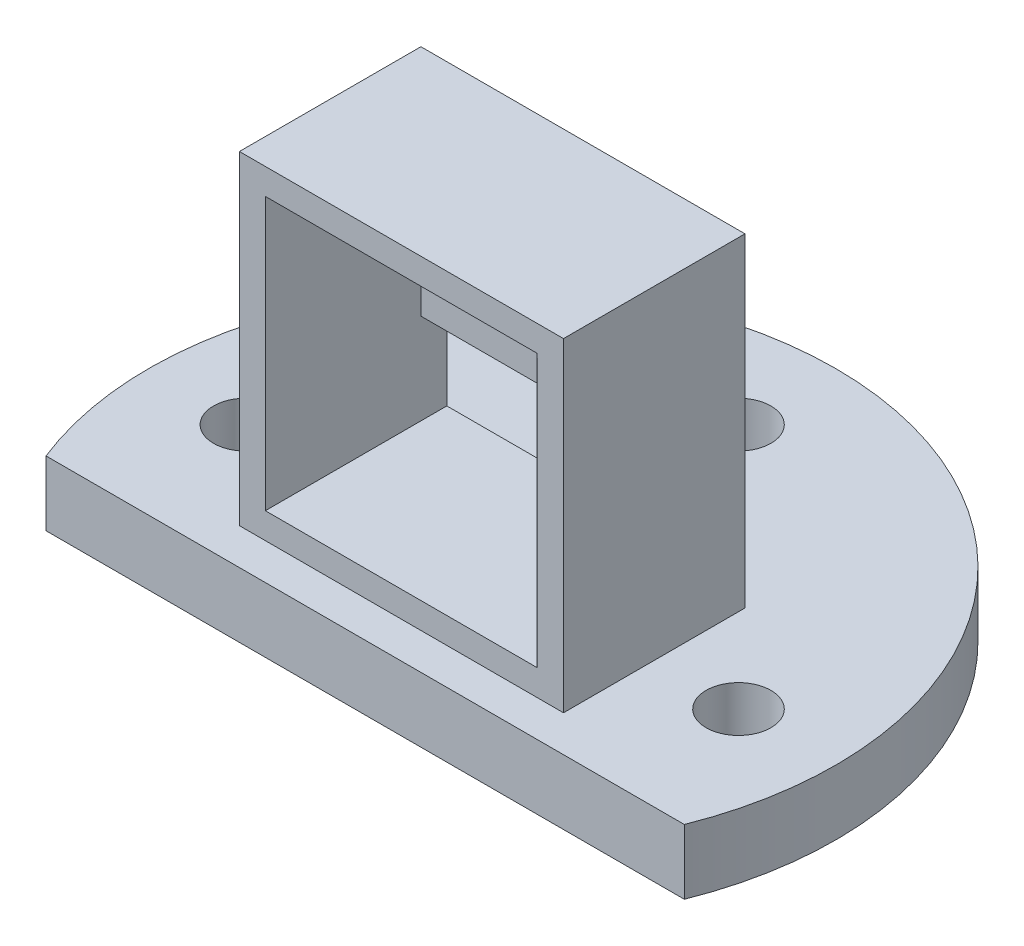
from build123d import *

# Parameters (mm, degrees)
SKETCH1_R           = 5
BOSS_EXTRUDE4_DEPTH = 10
SKETCH5_W           = 50
SKETCH5_H           = 28
BOSS_EXTRUDE5_DEPTH = 50
SKETCH6_W           = 42
SKETCH6_H           = 42
BOSS_EXTRUDE7_DEPTH = 24
SKETCH9_W           = 41.892865088
SKETCH9_H           = 42
CUT_EXTRUDE1_DEPTH  = 24
SKETCH10_W          = 41.892865088
SKETCH10_H          = 12
CUT_EXTRUDE6_DEPTH  = 4
SKETCH11_W          = 41.892865088
SKETCH11_H          = 14
CUT_EXTRUDE7_DEPTH  = 4


with BuildPart() as part:
    # Sketch1 → Boss-Extrude4 (new body)
    with BuildSketch(Plane(origin=(0, 0, 0), x_dir=(1, 0, 0), z_dir=(0, 1, 0))):
        with BuildLine():
            Line((-49.242854308, -19.599522943), (49.242854308, -19.599522943))
            ThreePointArc((49.242854308, -19.599522943), (0, 53), (-49.242854308, -19.599522943))
        make_face()
        with Locations(Location((-38, 0, 0), (0, 0, 270))):
            Circle(SKETCH1_R, mode=Mode.SUBTRACT)
        with Locations(Location((38, 0, 0), (0, 0, 270))):
            Circle(SKETCH1_R, mode=Mode.SUBTRACT)
        with Locations(Location((0, 38, 0), (0, 0, 270))):
            Circle(SKETCH1_R, mode=Mode.SUBTRACT)
    extrude(amount=BOSS_EXTRUDE4_DEPTH)

    # Sketch5 → Boss-Extrude5 (add)
    with BuildSketch(Plane(origin=(0, 10, 0), x_dir=(1, 0, 0), z_dir=(0, 1, 0))):
        Rectangle(SKETCH5_W, SKETCH5_H)
    extrude(amount=BOSS_EXTRUDE5_DEPTH)


with BuildPart() as body_2:
    # Sketch6 → Boss-Extrude7 (new body)
    with BuildSketch(Plane.XY.offset(14)):
        with Locations((0, 35)):
            Rectangle(SKETCH6_W, SKETCH6_H)
    extrude(amount=-BOSS_EXTRUDE7_DEPTH)


with BuildPart() as cut_extrude1_tool:
    # Sketch9 → Cut-Extrude1 (new body)
    with BuildSketch(Plane.XY.offset(14)):
        with Locations((-0.053567456, 35)):
            Rectangle(SKETCH9_W, SKETCH9_H)
    extrude(amount=-CUT_EXTRUDE1_DEPTH)


with BuildPart() as part_1:
    add(part.part)

    # Cut-Extrude1: cut by cut_extrude1_tool
    add(cut_extrude1_tool.part, mode=Mode.SUBTRACT)

    # Sketch10 → Cut-Extrude6 (cut)
    with BuildSketch(Plane.XY.offset(-10)):
        with Locations((-0.053567456, 50)):
            Rectangle(SKETCH10_W, SKETCH10_H)
    extrude(amount=-CUT_EXTRUDE6_DEPTH, mode=Mode.SUBTRACT)

    # Sketch11 → Cut-Extrude7 (cut)
    with BuildSketch(Plane.XY.offset(-10)):
        with Locations((-0.053567456, 21)):
            Rectangle(SKETCH11_W, SKETCH11_H)
    extrude(amount=-CUT_EXTRUDE7_DEPTH, mode=Mode.SUBTRACT)


with BuildPart() as body_2_1:
    add(body_2.part)

    # Cut-Extrude1: cut by cut_extrude1_tool
    add(cut_extrude1_tool.part, mode=Mode.SUBTRACT)


solid = Compound([part_1.part, body_2_1.part])
